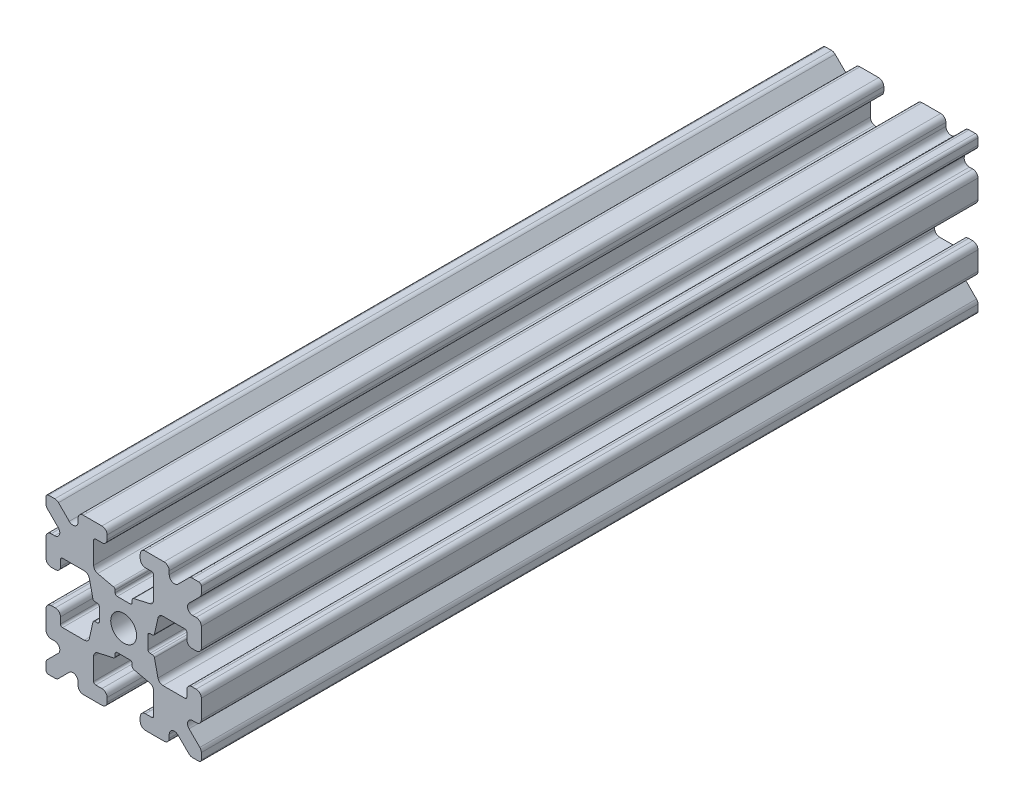
from build123d import *

# Parameters (mm, degrees)
SKETCH1_W           = 15
SKETCH1_H           = 15
SKETCH1_R           = 1.25
BOSS_EXTRUDE1_DEPTH = 37.5
FILLET1_R           = 0.25
CUT_EXTRUDE1_DEPTH  = 76.746287038
CUT_EXTRUDE3_DEPTH  = 76.746287038
FILLET3_R           = 0.5
FILLET4_R           = 0.5
FILLET5_R           = 3
FILLET6_R           = 0.2
CUT_EXTRUDE4_DEPTH  = 76.746287038
FILLET8_R           = 0.5
SKETCH6_W           = 5.1529354
SKETCH6_H           = 1.651
SKETCH6_W_2         = 1.651
SKETCH6_H_2         = 5.1529354
CUT_EXTRUDE5_DEPTH  = 76.746287038
FILLET10_R          = 0.2


with BuildPart() as part:
    # Sketch1 → Boss-Extrude1 (new, symmetric)
    with BuildSketch(Plane.XY):
        Rectangle(SKETCH1_W, SKETCH1_H)
        Circle(SKETCH1_R, mode=Mode.SUBTRACT)
    extrude(amount=BOSS_EXTRUDE1_DEPTH, both=True)

    # Fillet1
    fillet1_edges = [part.edges().sort_by_distance(p)[0] for p in [
        (7.5, -7.5, 0),
        (-7.5, -7.5, 0),
        (-7.5, 7.5, 0),
        (7.5, 7.5, 0),
    ]]
    fillet(fillet1_edges, radius=FILLET1_R)

    # Sketch2 → Cut-Extrude1 (cut, through all)
    with BuildSketch(Plane.XY.offset(37.5)):
        Polygon((-7.5, 1.6), (-6.1, 1.6), (-6.1, 2.9), (-3.4, 2.9), (-3.4, -2.9), (-6.1, -2.9), (-6.1, -1.6), (-7.5, -1.6), align=None)
        Polygon((2.9, 6.1), (1.6, 6.1), (1.6, 7.5), (-1.6, 7.5), (-1.6, 6.1), (-2.9, 6.1), (-2.9, 3.4), (2.9, 3.4), align=None)
        Polygon((-1.6, -7.5), (-1.6, -6.1), (-2.9, -6.1), (-2.9, -3.4), (2.9, -3.4), (2.9, -6.1), (1.6, -6.1), (1.6, -7.5), align=None)
        Polygon((6.1, -2.9), (6.1, -1.6), (7.5, -1.6), (7.5, 1.6), (6.1, 1.6), (6.1, 2.9), (3.4, 2.9), (3.4, -2.9), align=None)
    extrude(amount=-CUT_EXTRUDE1_DEPTH, mode=Mode.SUBTRACT)

    # Sketch4 → Cut-Extrude3 (cut, through all)
    with BuildSketch(Plane.XY.offset(37.5)):
        Polygon((-3.4, 2.9), (-2.75, 0), (-3.4, -2.9), align=None)
        Polygon((-2.9, 3.4), (0, 2.75), (2.9, 3.4), align=None)
        Polygon((3.4, 2.9), (2.75, 0), (3.4, -2.9), align=None)
        Polygon((-2.9, -3.4), (0, -2.75), (2.9, -3.4), align=None)
    extrude(amount=-CUT_EXTRUDE3_DEPTH, mode=Mode.SUBTRACT)

    # Fillet3
    fillet3_edges = [part.edges().sort_by_distance(p)[0] for p in [
        (1.6, -7.5, 0),
        (-1.6, -7.5, 0),
        (-1.6, -6.1, 0),
        (1.6, -6.1, 0),
        (6.1, 1.6, 0),
        (7.5, 1.6, 0),
        (7.5, -1.6, 0),
        (6.1, -1.6, 0),
        (-7.5, -1.6, 0),
        (-7.5, 1.6, 0),
        (-6.1, 1.6, 0),
        (-6.1, -1.6, 0),
        (-1.6, 6.1, 0),
        (-1.6, 7.5, 0),
        (1.6, 7.5, 0),
        (1.6, 6.1, 0),
    ]]
    fillet(fillet3_edges, radius=FILLET3_R)

    # Fillet4
    fillet4_edges = [part.edges().sort_by_distance(p)[0] for p in [
        (-2.9, -3.4, 0),
        (2.9, -3.4, 0),
        (3.4, -2.9, 0),
        (3.4, 2.9, 0),
        (-3.4, 2.9, 0),
        (-3.4, -2.9, 0),
        (2.9, 3.4, 0),
        (-2.9, 3.4, 0),
    ]]
    fillet(fillet4_edges, radius=FILLET4_R)

    # Fillet5
    fillet5_edges = [part.edges().sort_by_distance(p)[0] for p in [
        (-2.75, 0, 0),
        (0, 2.75, 0),
        (2.75, 0, 0),
        (0, -2.75, 0),
    ]]
    fillet(fillet5_edges, radius=FILLET5_R)

    # Fillet6
    fillet6_edges = [part.edges().sort_by_distance(p)[0] for p in [
        (-2.9, -6.1, 0),
        (2.9, -6.1, 0),
        (6.1, -2.9, 0),
        (6.1, 2.9, 0),
        (-6.1, 2.9, 0),
        (-6.1, -2.9, 0),
        (2.9, 6.1, 0),
        (-2.9, 6.1, 0),
    ]]
    fillet(fillet6_edges, radius=FILLET6_R)

    # Sketch5 → Cut-Extrude4 (cut, through all)
    with BuildSketch(Plane.XY.offset(37.5)):
        Polygon((-7.5, 6.439339828), (-5.460660172, 4.4), (-7.5, 4.4), align=None)
        Polygon((-6.439339828, 7.5), (-4.4, 5.460660172), (-4.4, 7.5), align=None)
        Polygon((4.4, 7.5), (6.439339828, 7.5), (4.4, 5.460660172), align=None)
        Polygon((7.5, 6.439339828), (7.5, 4.4), (5.460660172, 4.4), align=None)
        Polygon((7.5, -6.439339828), (5.460660172, -4.4), (7.5, -4.4), align=None)
        Polygon((6.439339828, -7.5), (4.4, -5.460660172), (4.4, -7.5), align=None)
        Polygon((-4.4, -7.5), (-6.439339828, -7.5), (-4.4, -5.460660172), align=None)
        Polygon((-7.5, -6.439339828), (-7.5, -4.4), (-5.460660172, -4.4), align=None)
    extrude(amount=-CUT_EXTRUDE4_DEPTH, mode=Mode.SUBTRACT)

    # Fillet8
    fillet8_edges = [part.edges().sort_by_distance(p)[0] for p in [
        (-7.5, 4.4, 0),
        (-7.5, 6.439339828, 0),
        (-5.460660172, 4.4, 0),
        (7.5, -4.4, 0),
        (7.5, -6.439339828, 0),
        (5.460660172, -4.4, 0),
        (5.460660172, 4.4, 0),
        (7.5, 6.439339828, 0),
        (7.5, 4.4, 0),
        (-4.4, 7.5, 0),
        (-4.4, 5.460660172, 0),
        (-6.439339828, 7.5, 0),
        (-5.460660172, -4.4, 0),
        (-7.5, -6.439339828, 0),
        (-7.5, -4.4, 0),
        (4.4, 5.460660172, 0),
        (4.4, 7.5, 0),
        (6.439339828, 7.5, 0),
        (6.439339828, -7.5, 0),
        (4.4, -7.5, 0),
        (4.4, -5.460660172, 0),
        (-6.439339828, -7.5, 0),
        (-4.4, -5.460660172, 0),
        (-4.4, -7.5, 0),
    ]]
    fillet(fillet8_edges, radius=FILLET8_R)

    # Sketch6 → Cut-Extrude5 (cut, through all)
    with BuildSketch(Plane.XY.offset(37.5)):
        with Locations((4.9235323, 0)):
            Rectangle(SKETCH6_W, SKETCH6_H)
        with Locations((0, -4.9235323)):
            Rectangle(SKETCH6_W_2, SKETCH6_H_2)
        with Locations((-4.9235323, 0)):
            Rectangle(SKETCH6_W, SKETCH6_H)
        with Locations((0, 4.9235323)):
            Rectangle(SKETCH6_W_2, SKETCH6_H_2)
    extrude(amount=-CUT_EXTRUDE5_DEPTH, mode=Mode.SUBTRACT)

    # Fillet10
    fillet10_edges = [part.edges().sort_by_distance(p)[0] for p in [
        (0.8255, -2.935025862, 0),
        (-0.8255, -2.935025862, 0),
        (0.8255, -2.3470646, 0),
        (-0.8255, -2.3470646, 0),
        (2.935025862, 0.8255, 0),
        (2.935025862, -0.8255, 0),
        (2.3470646, 0.8255, 0),
        (2.3470646, -0.8255, 0),
        (-2.935025862, -0.8255, 0),
        (-2.935025862, 0.8255, 0),
        (-2.3470646, -0.8255, 0),
        (-2.3470646, 0.8255, 0),
        (-0.8255, 2.935025862, 0),
        (0.8255, 2.935025862, 0),
        (-0.8255, 2.3470646, 0),
        (0.8255, 2.3470646, 0),
    ]]
    fillet(fillet10_edges, radius=FILLET10_R)


solid = part.part
